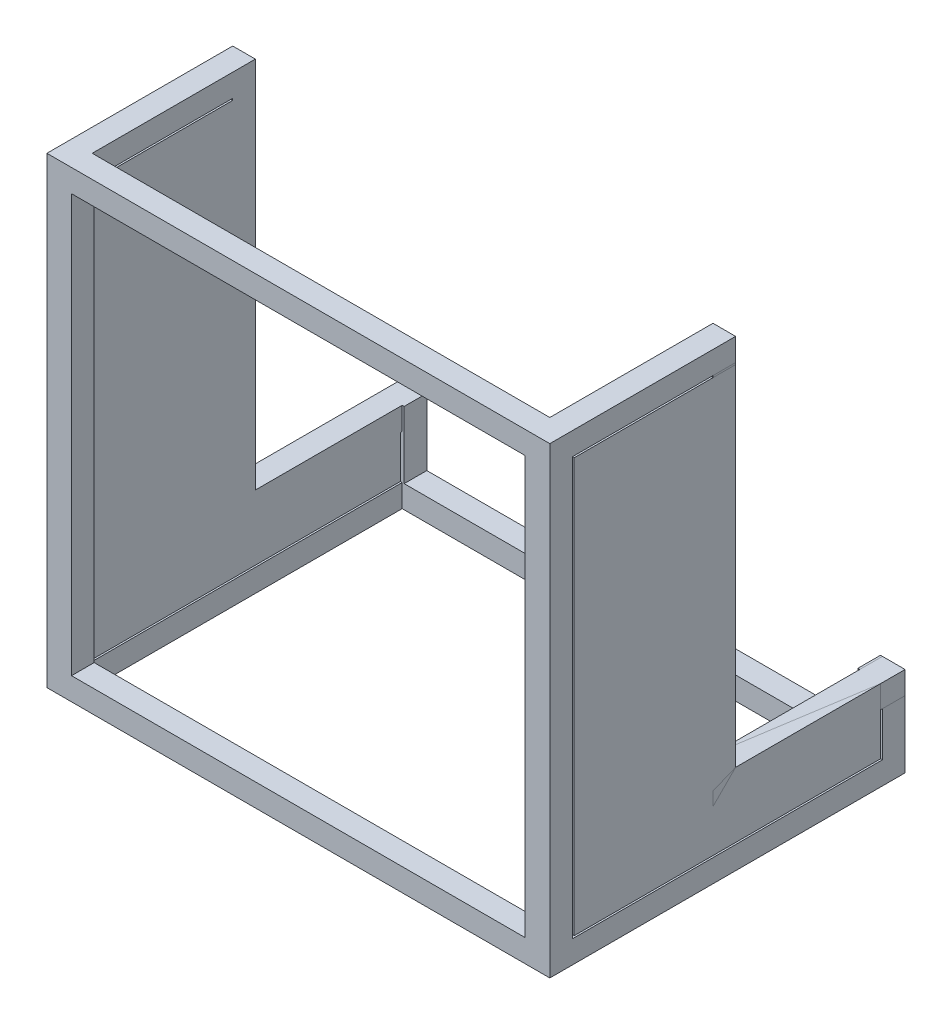
from build123d import *

# Parameters (mm, degrees)
CROQUIS1_W                   = 563.8
CROQUIS1_H                   = 518.8
CROQUIS1_W_2                 = 508.593677718
CROQUIS1_H_2                 = 468
SALIENTE_EXTRUIR1_DEPTH      = 398.31
CORTAR_EXTRUIR1_REACH        = 739.435
CROQUIS2_W                   = 347.51
CROQUIS2_H                   = 468
CROQUIS3_W                   = 513
CROQUIS3_H                   = 347.51
CORTAR_EXTRUIR2_DEPTH        = 410
CROQUIS4_W                   = 513
CROQUIS4_H                   = 347.51
CORTAR_EXTRUIR3_DEPTH        = 40
CROQUIS5_W                   = 343.51
CROQUIS5_H                   = 464
SALIENTE_EXTRUIR2_DEPTH      = 25.4
CROQUIS6_W                   = 343.51
CROQUIS6_H                   = 464
SALIENTE_EXTRUIR3_DEPTH      = 25.4
CROQUIS7_W                   = 190
CROQUIS7_H                   = 418.4
CORTAR_EXTRUIR6_DEPTH        = 584
SALIENTE_EXTRUIR4_DEPTH      = 25.4
SALIENTE_EXTRUIR5_DEPTH      = 0.02
SALIENTE_EXTRUIR5_DEPTH_BACK = 25.4


with BuildPart() as part:
    # Croquis1 → Saliente-Extruir1 (new body)
    with BuildSketch(Plane.XY):
        Rectangle(CROQUIS1_W, CROQUIS1_H)
        Rectangle(CROQUIS1_W_2, CROQUIS1_H_2, mode=Mode.SUBTRACT)
    extrude(amount=-SALIENTE_EXTRUIR1_DEPTH)

    # Cortar-Extruir1: up to this face of the body (flat: up to its plane)
    cortar_extruir1_end = Plane(part.part.faces().sort_by_distance((-281.9, 0, -199.155))[0])
    # Croquis2 → Cortar-Extruir1 (cut, up to the picked face)
    with BuildSketch(Plane(origin=(281.9, 0, 0), x_dir=(0, 0, -1), z_dir=(1, 0, 0)), mode=Mode.PRIVATE) as cortar_extruir1_sk1:
        with Locations((199.155, 0)):
            Rectangle(CROQUIS2_W, CROQUIS2_H)
    cortar_extruir1_tool1 = split(extrude(cortar_extruir1_sk1.sketch, amount=-CORTAR_EXTRUIR1_REACH, mode=Mode.PRIVATE), bisect_by=cortar_extruir1_end, keep=Keep.BOTH, mode=Mode.PRIVATE)
    add(cortar_extruir1_tool1.solids().sort_by(Axis((281.9, 0, -199.155), (-1, 0, 0)))[0], mode=Mode.SUBTRACT)

    # Croquis3 → Cortar-Extruir2 (cut)
    with BuildSketch(Plane(origin=(0, 259.4, 0), x_dir=(1, 0, 0), z_dir=(0, 1, 0))):
        with Locations((0, 199.155)):
            Rectangle(CROQUIS3_W, CROQUIS3_H)
    extrude(amount=-CORTAR_EXTRUIR2_DEPTH, mode=Mode.SUBTRACT)

    # Croquis4 → Cortar-Extruir3 (cut)
    with BuildSketch(Plane.XZ.offset(259.4)):
        with Locations((0, -199.155)):
            Rectangle(CROQUIS4_W, CROQUIS4_H)
    extrude(amount=-CORTAR_EXTRUIR3_DEPTH, mode=Mode.SUBTRACT)


with BuildPart() as body_2:
    # Croquis5 → Saliente-Extruir2 (new body)
    with BuildSketch(Plane(origin=(281.9, 0, 0), x_dir=(0, 0, -1), z_dir=(1, 0, 0))):
        with Locations((199.155, 0)):
            Rectangle(CROQUIS5_W, CROQUIS5_H)
    extrude(amount=-SALIENTE_EXTRUIR2_DEPTH)


with BuildPart() as body_3:
    # Croquis6 → Saliente-Extruir3 (new body)
    with BuildSketch(Plane.ZY.offset(281.9)):
        with Locations((-199.155, 0)):
            Rectangle(CROQUIS6_W, CROQUIS6_H)
    extrude(amount=-SALIENTE_EXTRUIR3_DEPTH)


with BuildPart() as cortar_extruir6_tool:
    # Croquis7 → Cortar-Extruir6 (new body)
    with BuildSketch(Plane.ZY.offset(281.9)):
        with Locations((-303.31, 50.2)):
            Rectangle(CROQUIS7_W, CROQUIS7_H)
    extrude(amount=-CORTAR_EXTRUIR6_DEPTH)


with BuildPart() as part_1:
    add(part.part)

    # Cortar-Extruir6: cut by cortar_extruir6_tool
    add(cortar_extruir6_tool.part, mode=Mode.SUBTRACT)



with BuildPart() as body_2_1:
    add(body_2.part)

    # Cortar-Extruir6: cut by cortar_extruir6_tool
    add(cortar_extruir6_tool.part, mode=Mode.SUBTRACT)


with BuildPart() as body_3_1:
    add(body_3.part)

    # Cortar-Extruir6: cut by cortar_extruir6_tool
    add(cortar_extruir6_tool.part, mode=Mode.SUBTRACT)


with BuildPart() as body_4:
    # Croquis9 → Saliente-Extruir4 (new body)
    with BuildSketch(Plane(origin=(281.9, 0, 0), x_dir=(0, 0, -1), z_dir=(1, 0, 0))):
        Polygon((208.31, 234), (208.31, -159), (398.31, -159), (398.31, -184.4), (182.91, -184.4), (182.91, 234), align=None)
    extrude(amount=-SALIENTE_EXTRUIR4_DEPTH)


with BuildPart() as part_2:
    add(part_1.part)

    add(body_3_1.part)  # Saliente-Extruir5 merges body 3
    # Croquis10 → Saliente-Extruir5 (add, two sides: drawn at the far end of the back side and taken through both)
    with BuildSketch(Plane.ZY.offset(281.9).offset(-SALIENTE_EXTRUIR5_DEPTH_BACK)):
        Polygon((-182.91, 234), (-208.31, 234), (-208.31, -159), (-372.91, -159), (-372.91, -184.4), (-182.91, -184.4), align=None)
    extrude(amount=SALIENTE_EXTRUIR5_DEPTH + SALIENTE_EXTRUIR5_DEPTH_BACK)


solid = Compound([body_2_1.part, body_4.part, part_2.part])
